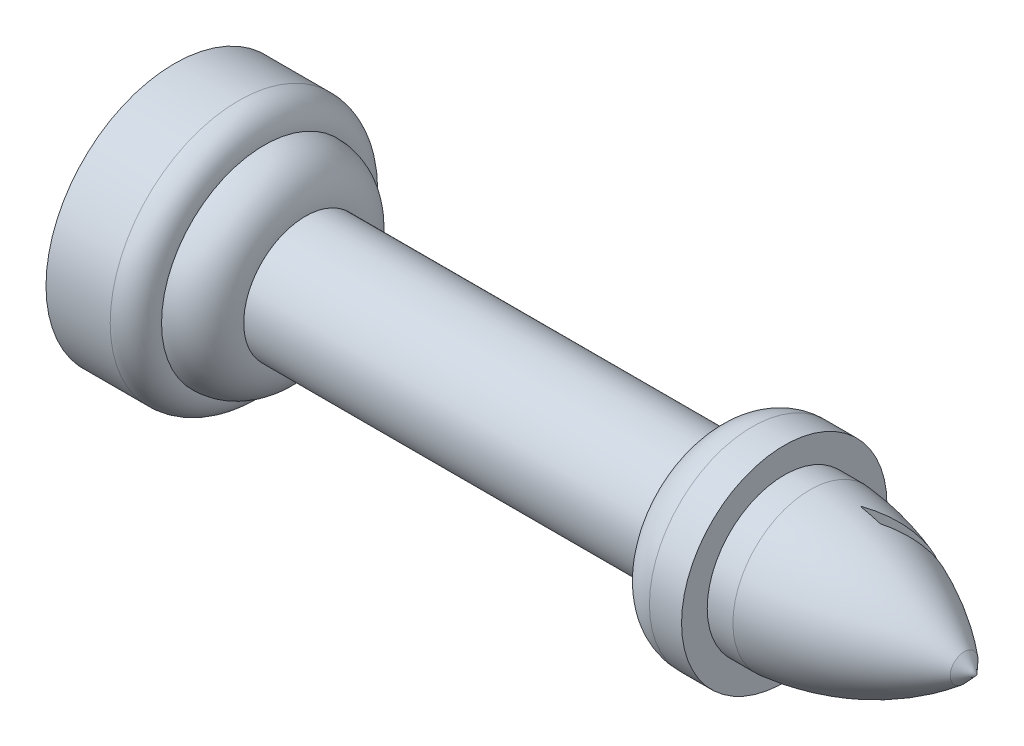
from build123d import *

# Parameters (mm, degrees)
SKETCH_990_W        = 31.6
SKETCH_990_H        = 4.8
SKETCH_990_W_2      = 2.5
SKETCH_990_H_2      = 8
CUT_EXTRUDE_3_DEPTH = 10


with BuildPart() as part:
    # Sketch 1486 → Повернуть1 (revolve)
    with BuildSketch(Plane(origin=(0, 0, 0), x_dir=(1, 0, 0), z_dir=(0, 1, 0)), mode=Mode.PRIVATE) as revolve_1_sk:
        with BuildLine():
            Line((47.5, 6), (49.5, 6))
            ThreePointArc((49.5, 6), (55.875273415, 4.446872371), (61.508920276, 1.082598365))
            Line((61.508920276, 1.082598365), (62.5, 0))
            Line((62.5, 0), (47.5, 0))
            Line((47.5, 0), (47.5, 6))
        make_face()
    revolve(revolve_1_sk.sketch.rotate(Axis((47.5, 0, 0), (1, 0, 0)), 180), axis=Axis((47.5, 0, 0), (1, 0, 0)))

    # Sketch 990 → Повернуть2 (revolve)
    with BuildSketch(Plane(origin=(0, 0, 0), x_dir=(1, 0, 0), z_dir=(0, 1, 0))):
        with Locations((26, 2.4)):
            Rectangle(SKETCH_990_W, SKETCH_990_H)
        with BuildLine():
            ThreePointArc((41.8, 4.8), (42.7372583, 7.0627417), (45, 8))
            Line((45, 8), (45, 0))
            Line((45, 0), (41.8, 0))
            Line((41.8, 0), (41.8, 4.8))
        make_face()
        with Locations((46.25, 4)):
            Rectangle(SKETCH_990_W_2, SKETCH_990_H_2)
    revolve(axis=Axis((41.8, 0, 0), (-1, 0, 0)))

    # Sketch 1793 → Вырез-Вытянуть3 (cut)
    with BuildSketch(Plane(origin=(0, 0, 0), x_dir=(1, 0, 0), z_dir=(0, 1, 0))):
        with BuildLine():
            Line((52, 1.4), (55.280421932, 4.680421932))
            ThreePointArc((55.280421932, 4.680421932), (55.851784453, 4.456474796), (56.416678349, 4.216678349))
            Line((56.416678349, 4.216678349), (53.6, 1.4))
            Line((53.6, 1.4), (52, 1.4))
        make_face()
    cut_extrude_3 = extrude(amount=-CUT_EXTRUDE_3_DEPTH, mode=Mode.SUBTRACT)

    # Зеркальное отражение1: Вырез-Вытянуть3 across plane
    add(cut_extrude_3.mirror(Plane(origin=(47.538581362, 0, 15.912390032), x_dir=(0, 0, 1), z_dir=(0, -1, 0))), mode=Mode.SUBTRACT)


with BuildPart() as body_2:
    # Sketch 159 → Повернуть3 (revolve)
    with BuildSketch(Plane(origin=(0, 0, 0), x_dir=(1, 0, 0), z_dir=(0, 1, 0)), mode=Mode.PRIVATE) as revolve_3_sk:
        Polygon((0, 10), (0, 0), (1, 0), (1, 5.25), (3.5, 5.25), (3.5, 0), (5, 0), (5, 10), align=None)
        with BuildLine():
            ThreePointArc((7, 8), (6.414213562, 9.414213562), (5, 10))
            Line((5, 10), (5, 0))
            Line((5, 0), (7, 0))
            Line((7, 0), (7, 8))
        make_face()
        with BuildLine():
            ThreePointArc((10.2, 4.8), (9.2627417, 7.0627417), (7, 8))
            Line((7, 8), (7, 0))
            Line((7, 0), (10.2, 0))
            Line((10.2, 0), (10.2, 4.8))
        make_face()
    revolve(revolve_3_sk.sketch.rotate(Axis((0, 0, 0), (1, 0, 0)), 180), axis=Axis((0, 0, 0), (1, 0, 0)))


solid = Compound([part.part, body_2.part])
